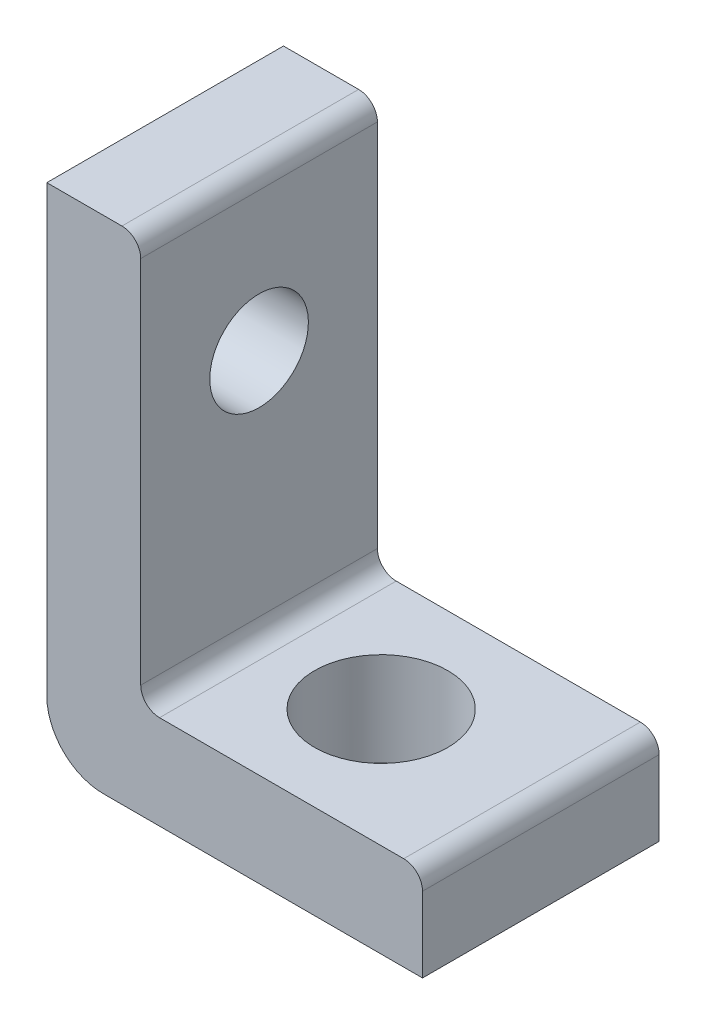
from build123d import *

# Parameters (mm, degrees)
BOSS_EXTRUDE1_DEPTH     = 6
FILLET1_R               = 0.9525
FILLET2_R               = 2.8575
F_1_4_CLEARANCE_HOLE1_D = 6.7564
CUT_EXTRUDE1_REACH      = 34.312
SKETCH7_R               = 2.5


with BuildPart() as part:
    # Sketch3 → Boss-Extrude1 (new, symmetric)
    with BuildSketch(Plane.XY):
        Polygon((4.7625, 25.4), (0, 25.4), (0, 0), (19.05, 0), (19.05, 4.7625), (4.7625, 4.7625), align=None)
    extrude(amount=BOSS_EXTRUDE1_DEPTH, both=True)

    # Fillet1
    fillet1_edges = [part.edges().sort_by_distance(p)[0] for p in [
        (4.7625, 4.7625, 0),
        (19.05, 4.7625, 0),
        (4.7625, 25.4, 0),
    ]]
    fillet(fillet1_edges, radius=FILLET1_R)

    # Fillet2
    fillet2_edges = [part.edges().sort_by_distance(p)[0] for p in [
        (0, 0, 0),
    ]]
    fillet(fillet2_edges, radius=FILLET2_R)

    # 1/4 Clearance Hole1 (through all)
    with Locations(Plane(origin=(0, 0, 0), x_dir=(-1, 0, 0), z_dir=(0, -1, 0))):
        with Locations((-10.95375, 0)):
            Hole(F_1_4_CLEARANCE_HOLE1_D / 2)

    # Sketch7 → Cut-Extrude1 (cut, up to next)
    with BuildSketch(Plane.ZY, mode=Mode.PRIVATE) as cut_extrude1_sk1:
        with Locations(Location((0, 17.4, 0), (0, 0, 270))):
            Circle(SKETCH7_R)
    cut_extrude1_tool1 = extrude(cut_extrude1_sk1.sketch, amount=-CUT_EXTRUDE1_REACH, mode=Mode.PRIVATE) & part.part
    add(cut_extrude1_tool1.solids().sort_by_distance((0, 17.4, 0))[0], mode=Mode.SUBTRACT)


solid = part.part
